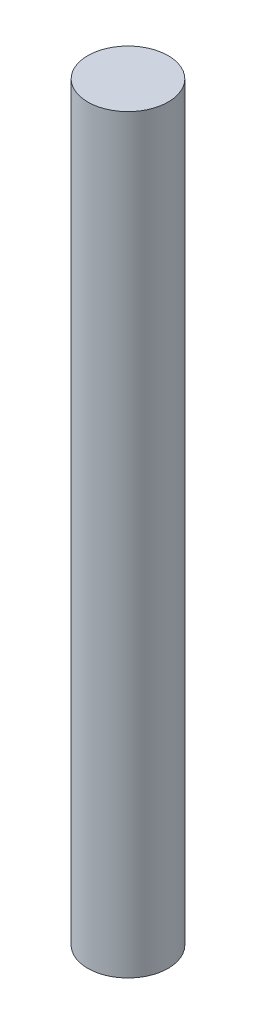
from build123d import *

# Parameters (mm, degrees)
SKETCH1_R           = 9.525
BOSS_EXTRUDE1_DEPTH = 177.8


with BuildPart() as part:
    # Sketch1 → Boss-Extrude1 (new body)
    with BuildSketch(Plane(origin=(0, 0, 0), x_dir=(1, 0, 0), z_dir=(0, 1, 0))):
        with Locations(Location((0, 0, 0), (0, 0, 270))):
            Circle(SKETCH1_R)
    extrude(amount=BOSS_EXTRUDE1_DEPTH)


solid = part.part
